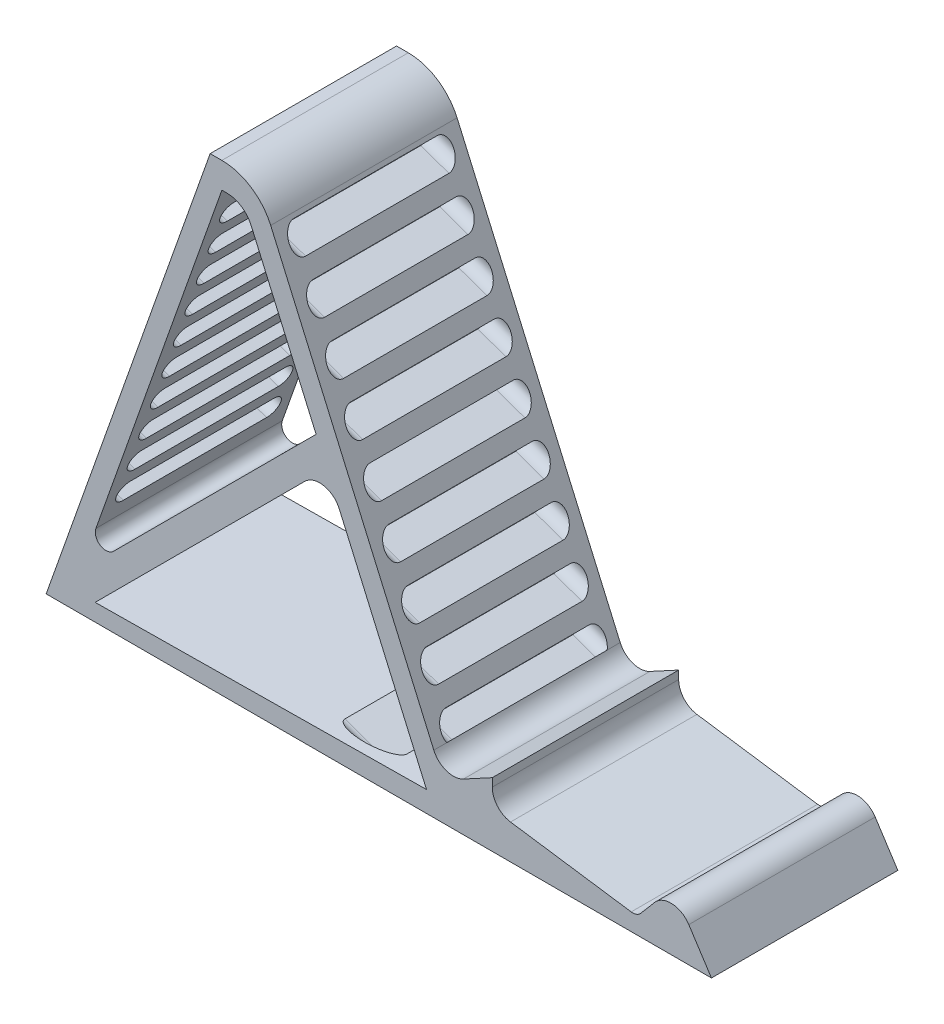
from build123d import *

# Parameters (mm, degrees)
BOSS_EXTRUDE1_DEPTH = 35
CUT_EXTRUDE4_REACH  = 134.689


with BuildPart() as part:
    # Sketch1 → Boss-Extrude1 (new body)
    with BuildSketch(Plane.XY):
        with BuildLine():
            Line((3.825612986, 2.071685582), (9.233092656, 5))
            Line((9.233092656, 5), (9.233092656, 3.461642908))
            ThreePointArc((9.233092656, 3.461642908), (10.208457007, 0.844090771), (12.65888225, -0.496927845))
            Line((12.65888225, -0.496927845), (35.317752009, -3.783709775))
            ThreePointArc((35.317752009, -3.783709775), (36.311462951, -3.675442391), (37.128666736, -3.099802542))
            Line((37.128666736, -3.099802542), (39.735229419, -0.033589745))
            ThreePointArc((39.735229419, -0.033589745), (43.039848781, 1.367389285), (46.137530664, -0.445789778))
            Line((46.137530664, -0.445789778), (50.393884867, -7))
            Line((50.393884867, -7), (-74.541777264, -7))
            Line((-74.541777264, -7), (-43.743273628, 80))
            Line((-43.743273628, 80), (-41.540155748, 80))
            ThreePointArc((-41.540155748, 80), (-36.066668898, 78.369046642), (-32.378582399, 74.00818834))
            Line((-32.378582399, 74.00818834), (-1.743778258, 3.985778876))
            ThreePointArc((-1.743778258, 3.985778876), (0.620765841, 1.806227443), (3.825612986, 2.071685582))
        make_face()
        with BuildLine():
            Line((-41.540155748, 75.154954726), (-65.196538206, 8.330108359))
            ThreePointArc((-65.196538206, 8.330108359), (-64.378332596, 5.971174467), (-61.896974762, 6.248470025))
            Line((-61.896974762, 6.248470025), (-23.851576734, 44.293868053))
            Line((-23.851576734, 44.293868053), (-36.042593353, 72.159048896))
            ThreePointArc((-36.042593353, 72.159048896), (-37.886636603, 74.339478047), (-40.623380028, 75.154954726))
            Line((-40.623380028, 75.154954726), (-41.540155748, 75.154954726))
        make_face(mode=Mode.SUBTRACT)
        with BuildLine():
            Line((-65.342221776, -3.779359845), (-3.115558181, -3.102745784))
            Line((-3.115558181, -3.102745784), (-19.499162049, 34.345491629))
            ThreePointArc((-19.499162049, 34.345491629), (-22.422132598, 36.672857747), (-25.992218513, 35.570643418))
            Line((-25.992218513, 35.570643418), (-65.342221776, -3.779359845))
        make_face(mode=Mode.SUBTRACT)
    extrude(amount=BOSS_EXTRUDE1_DEPTH)

    # Cut-Extrude4: up to this plane
    cut_extrude4_end = Plane(origin=(-1.743778258, 3.985778876, 35), z_dir=(-0.9161573349021892, -0.4008188340197079, 0))
    # Sketch3 → Cut-Extrude4 (cut, up to the surface)
    with BuildSketch(Plane(origin=(-64.038433893, 22.669976312, 0), x_dir=(0, 0, 1), z_dir=(-0.942674940489457, 0.3337123860050733, 0)), mode=Mode.PRIVATE) as cut_extrude4_sk1:
        with BuildLine():
            Line((4.044427995, 58.386115653), (30.955572005, 58.386115653))
            ThreePointArc((30.955572005, 58.386115653), (32.959771359, 56.381916299), (30.955572005, 54.377716946))
            Line((30.955572005, 54.377716946), (4.044427995, 54.377716946))
            ThreePointArc((4.044427995, 54.377716946), (2.040228641, 56.381916299), (4.044427995, 58.386115653))
        make_face()
    cut_extrude4_tool1 = split(extrude(cut_extrude4_sk1.sketch, amount=-CUT_EXTRUDE4_REACH, mode=Mode.PRIVATE), bisect_by=cut_extrude4_end, keep=Keep.BOTH, mode=Mode.PRIVATE)
    add(cut_extrude4_tool1.solids().sort_by_distance((-45.22309, 75.819796, 17.5))[0], mode=Mode.SUBTRACT)
    # Sketch3 → Cut-Extrude4 (cut, up to the surface)
    with BuildSketch(Plane(origin=(-64.038433893, 22.669976312, 0), x_dir=(0, 0, 1), z_dir=(-0.942674940489457, 0.3337123860050733, 0)), mode=Mode.PRIVATE) as cut_extrude4_sk2:
        with BuildLine():
            Line((4.044427995, 51.886115653), (30.955572005, 51.886115653))
            ThreePointArc((30.955572005, 51.886115653), (32.959771359, 49.881916299), (30.955572005, 47.877716946))
            Line((30.955572005, 47.877716946), (4.044427995, 47.877716946))
            ThreePointArc((4.044427995, 47.877716946), (2.040228641, 49.881916299), (4.044427995, 51.886115653))
        make_face()
    cut_extrude4_tool2 = split(extrude(cut_extrude4_sk2.sketch, amount=-CUT_EXTRUDE4_REACH, mode=Mode.PRIVATE), bisect_by=cut_extrude4_end, keep=Keep.BOTH, mode=Mode.PRIVATE)
    add(cut_extrude4_tool2.solids().sort_by_distance((-47.392221, 69.692409, 17.5))[0], mode=Mode.SUBTRACT)
    # Sketch3 → Cut-Extrude4 (cut, up to the surface)
    with BuildSketch(Plane(origin=(-64.038433893, 22.669976312, 0), x_dir=(0, 0, 1), z_dir=(-0.942674940489457, 0.3337123860050733, 0)), mode=Mode.PRIVATE) as cut_extrude4_sk3:
        with BuildLine():
            Line((4.044427995, 45.386115653), (30.955572005, 45.386115653))
            ThreePointArc((30.955572005, 45.386115653), (32.959771359, 43.381916299), (30.955572005, 41.377716946))
            Line((30.955572005, 41.377716946), (4.044427995, 41.377716946))
            ThreePointArc((4.044427995, 41.377716946), (2.040228641, 43.381916299), (4.044427995, 45.386115653))
        make_face()
    cut_extrude4_tool3 = split(extrude(cut_extrude4_sk3.sketch, amount=-CUT_EXTRUDE4_REACH, mode=Mode.PRIVATE), bisect_by=cut_extrude4_end, keep=Keep.BOTH, mode=Mode.PRIVATE)
    add(cut_extrude4_tool3.solids().sort_by_distance((-49.561351, 63.565022, 17.5))[0], mode=Mode.SUBTRACT)
    # Sketch3 → Cut-Extrude4 (cut, up to the surface)
    with BuildSketch(Plane(origin=(-64.038433893, 22.669976312, 0), x_dir=(0, 0, 1), z_dir=(-0.942674940489457, 0.3337123860050733, 0)), mode=Mode.PRIVATE) as cut_extrude4_sk4:
        with BuildLine():
            Line((4.044427995, 38.886115653), (30.955572005, 38.886115653))
            ThreePointArc((30.955572005, 38.886115653), (32.959771359, 36.881916299), (30.955572005, 34.877716946))
            Line((30.955572005, 34.877716946), (4.044427995, 34.877716946))
            ThreePointArc((4.044427995, 34.877716946), (2.040228641, 36.881916299), (4.044427995, 38.886115653))
        make_face()
    cut_extrude4_tool4 = split(extrude(cut_extrude4_sk4.sketch, amount=-CUT_EXTRUDE4_REACH, mode=Mode.PRIVATE), bisect_by=cut_extrude4_end, keep=Keep.BOTH, mode=Mode.PRIVATE)
    add(cut_extrude4_tool4.solids().sort_by_distance((-51.730482, 57.437635, 17.5))[0], mode=Mode.SUBTRACT)
    # Sketch3 → Cut-Extrude4 (cut, up to the surface)
    with BuildSketch(Plane(origin=(-64.038433893, 22.669976312, 0), x_dir=(0, 0, 1), z_dir=(-0.942674940489457, 0.3337123860050733, 0)), mode=Mode.PRIVATE) as cut_extrude4_sk5:
        with BuildLine():
            Line((4.044427995, 32.386115653), (30.955572005, 32.386115653))
            ThreePointArc((30.955572005, 32.386115653), (32.959771359, 30.381916299), (30.955572005, 28.377716946))
            Line((30.955572005, 28.377716946), (4.044427995, 28.377716946))
            ThreePointArc((4.044427995, 28.377716946), (2.040228641, 30.381916299), (4.044427995, 32.386115653))
        make_face()
    cut_extrude4_tool5 = split(extrude(cut_extrude4_sk5.sketch, amount=-CUT_EXTRUDE4_REACH, mode=Mode.PRIVATE), bisect_by=cut_extrude4_end, keep=Keep.BOTH, mode=Mode.PRIVATE)
    add(cut_extrude4_tool5.solids().sort_by_distance((-53.899612, 51.310247, 17.5))[0], mode=Mode.SUBTRACT)
    # Sketch3 → Cut-Extrude4 (cut, up to the surface)
    with BuildSketch(Plane(origin=(-64.038433893, 22.669976312, 0), x_dir=(0, 0, 1), z_dir=(-0.942674940489457, 0.3337123860050733, 0)), mode=Mode.PRIVATE) as cut_extrude4_sk6:
        with BuildLine():
            Line((4.044427995, 25.886115653), (30.955572005, 25.886115653))
            ThreePointArc((30.955572005, 25.886115653), (32.959771359, 23.881916299), (30.955572005, 21.877716946))
            Line((30.955572005, 21.877716946), (4.044427995, 21.877716946))
            ThreePointArc((4.044427995, 21.877716946), (2.040228641, 23.881916299), (4.044427995, 25.886115653))
        make_face()
    cut_extrude4_tool6 = split(extrude(cut_extrude4_sk6.sketch, amount=-CUT_EXTRUDE4_REACH, mode=Mode.PRIVATE), bisect_by=cut_extrude4_end, keep=Keep.BOTH, mode=Mode.PRIVATE)
    add(cut_extrude4_tool6.solids().sort_by_distance((-56.068743, 45.18286, 17.5))[0], mode=Mode.SUBTRACT)
    # Sketch3 → Cut-Extrude4 (cut, up to the surface)
    with BuildSketch(Plane(origin=(-64.038433893, 22.669976312, 0), x_dir=(0, 0, 1), z_dir=(-0.942674940489457, 0.3337123860050733, 0)), mode=Mode.PRIVATE) as cut_extrude4_sk7:
        with BuildLine():
            Line((4.044427995, 19.386115653), (30.955572005, 19.386115653))
            ThreePointArc((30.955572005, 19.386115653), (32.959771359, 17.381916299), (30.955572005, 15.377716946))
            Line((30.955572005, 15.377716946), (4.044427995, 15.377716946))
            ThreePointArc((4.044427995, 15.377716946), (2.040228641, 17.381916299), (4.044427995, 19.386115653))
        make_face()
    cut_extrude4_tool7 = split(extrude(cut_extrude4_sk7.sketch, amount=-CUT_EXTRUDE4_REACH, mode=Mode.PRIVATE), bisect_by=cut_extrude4_end, keep=Keep.BOTH, mode=Mode.PRIVATE)
    add(cut_extrude4_tool7.solids().sort_by_distance((-58.237873, 39.055473, 17.5))[0], mode=Mode.SUBTRACT)
    # Sketch3 → Cut-Extrude4 (cut, up to the surface)
    with BuildSketch(Plane(origin=(-64.038433893, 22.669976312, 0), x_dir=(0, 0, 1), z_dir=(-0.942674940489457, 0.3337123860050733, 0)), mode=Mode.PRIVATE) as cut_extrude4_sk8:
        with BuildLine():
            Line((4.044427995, 12.886115653), (30.955572005, 12.886115653))
            ThreePointArc((30.955572005, 12.886115653), (32.959771359, 10.881916299), (30.955572005, 8.877716946))
            Line((30.955572005, 8.877716946), (4.044427995, 8.877716946))
            ThreePointArc((4.044427995, 8.877716946), (2.040228641, 10.881916299), (4.044427995, 12.886115653))
        make_face()
    cut_extrude4_tool8 = split(extrude(cut_extrude4_sk8.sketch, amount=-CUT_EXTRUDE4_REACH, mode=Mode.PRIVATE), bisect_by=cut_extrude4_end, keep=Keep.BOTH, mode=Mode.PRIVATE)
    add(cut_extrude4_tool8.solids().sort_by_distance((-60.407004, 32.928086, 17.5))[0], mode=Mode.SUBTRACT)
    # Sketch3 → Cut-Extrude4 (cut, up to the surface)
    with BuildSketch(Plane(origin=(-64.038433893, 22.669976312, 0), x_dir=(0, 0, 1), z_dir=(-0.942674940489457, 0.3337123860050733, 0)), mode=Mode.PRIVATE) as cut_extrude4_sk9:
        with BuildLine():
            Line((4.044427995, 6.386115653), (30.955572005, 6.386115653))
            ThreePointArc((30.955572005, 6.386115653), (32.959771359, 4.381916299), (30.955572005, 2.377716946))
            Line((30.955572005, 2.377716946), (4.044427995, 2.377716946))
            ThreePointArc((4.044427995, 2.377716946), (2.040228641, 4.381916299), (4.044427995, 6.386115653))
        make_face()
    cut_extrude4_tool9 = split(extrude(cut_extrude4_sk9.sketch, amount=-CUT_EXTRUDE4_REACH, mode=Mode.PRIVATE), bisect_by=cut_extrude4_end, keep=Keep.BOTH, mode=Mode.PRIVATE)
    add(cut_extrude4_tool9.solids().sort_by_distance((-62.576134, 26.800699, 17.5))[0], mode=Mode.SUBTRACT)
    # Sketch3 → Cut-Extrude4 (cut, up to the surface)
    with BuildSketch(Plane(origin=(-64.038433893, 22.669976312, 0), x_dir=(0, 0, 1), z_dir=(-0.942674940489457, 0.3337123860050733, 0)), mode=Mode.PRIVATE) as cut_extrude4_sk10:
        with BuildLine():
            Line((4.044427995, -0.113884347), (30.955572005, -0.113884347))
            ThreePointArc((30.955572005, -0.113884347), (32.959771359, -2.118083701), (30.955572005, -4.122283054))
            Line((30.955572005, -4.122283054), (4.044427995, -4.122283054))
            ThreePointArc((4.044427995, -4.122283054), (2.040228641, -2.118083701), (4.044427995, -0.113884347))
        make_face()
    cut_extrude4_tool10 = split(extrude(cut_extrude4_sk10.sketch, amount=-CUT_EXTRUDE4_REACH, mode=Mode.PRIVATE), bisect_by=cut_extrude4_end, keep=Keep.BOTH, mode=Mode.PRIVATE)
    add(cut_extrude4_tool10.solids().sort_by_distance((-64.745265, 20.673312, 17.5))[0], mode=Mode.SUBTRACT)
    # Sketch3 → Cut-Extrude4 (cut, up to the surface)
    with BuildSketch(Plane(origin=(-64.038433893, 22.669976312, 0), x_dir=(0, 0, 1), z_dir=(-0.942674940489457, 0.3337123860050733, 0)), mode=Mode.PRIVATE) as cut_extrude4_sk11:
        with BuildLine():
            Line((4.044427995, -6.613884347), (30.955572005, -6.613884347))
            ThreePointArc((30.955572005, -6.613884347), (32.959771359, -8.618083701), (30.955572005, -10.622283054))
            Line((30.955572005, -10.622283054), (4.044427995, -10.622283054))
            ThreePointArc((4.044427995, -10.622283054), (2.040228641, -8.618083701), (4.044427995, -6.613884347))
        make_face()
    cut_extrude4_tool11 = split(extrude(cut_extrude4_sk11.sketch, amount=-CUT_EXTRUDE4_REACH, mode=Mode.PRIVATE), bisect_by=cut_extrude4_end, keep=Keep.BOTH, mode=Mode.PRIVATE)
    add(cut_extrude4_tool11.solids().sort_by_distance((-66.914395, 14.545925, 17.5))[0], mode=Mode.SUBTRACT)


solid = part.part
